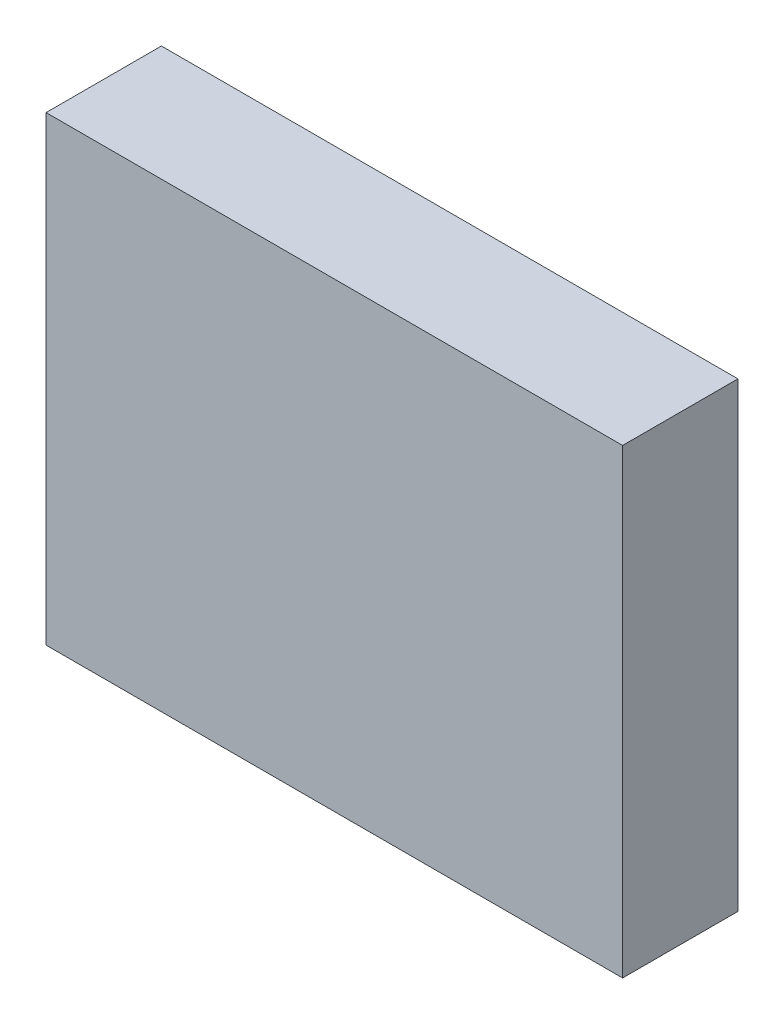
from build123d import *

# Parameters (mm, degrees)
SKETCH_1_W      = 100
SKETCH_1_H      = 80
EXTRUDE_1_DEPTH = 20


with BuildPart() as part:
    # 草图1 → 凸台-拉伸1 (new body)
    with BuildSketch(Plane.XY):
        Rectangle(SKETCH_1_W, SKETCH_1_H)
    extrude(amount=EXTRUDE_1_DEPTH)


solid = part.part
